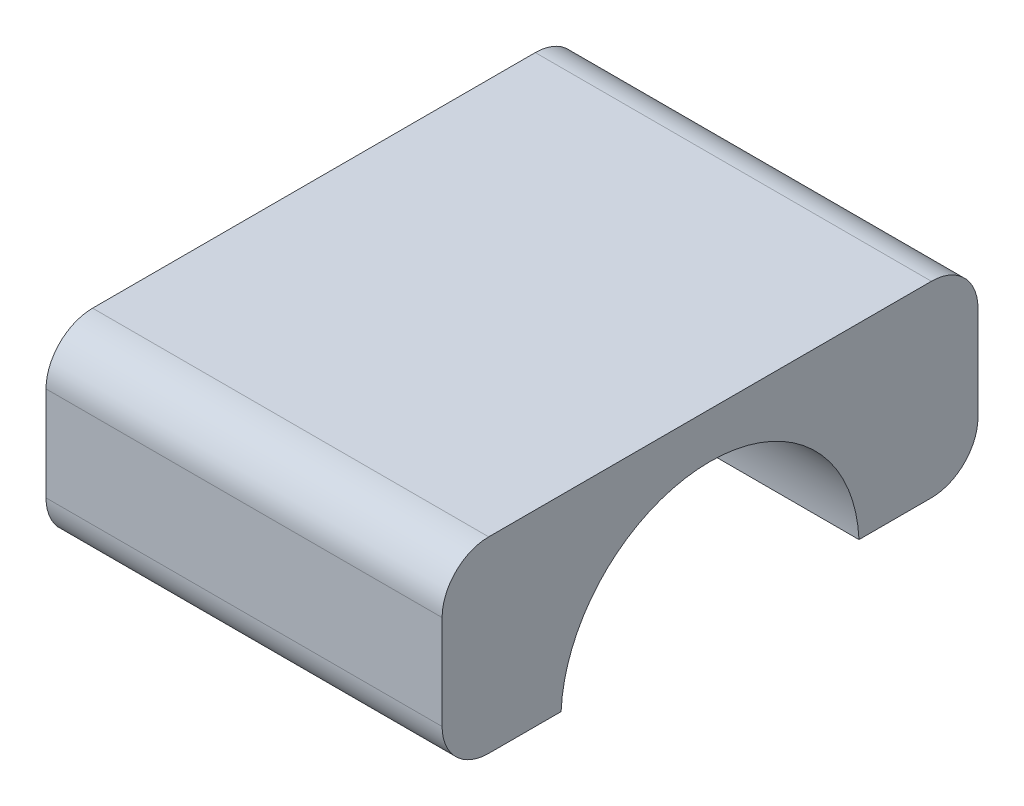
from build123d import *

# Parameters (mm, degrees)
BOSS_EXTRUDE1_DEPTH     = 17
CUT_EXTRUDE1_DEPTH      = 34.119329703
CUT_EXTRUDE1_DEPTH_BACK = 34.119329703
SKETCH2_R               = 12.8
SKETCH3_R               = 2
CUT_EXTRUDE2_DEPTH      = 7.5


with BuildPart() as part:
    # Sketch1 → Boss-Extrude1 (new, symmetric)
    with BuildSketch(Plane(origin=(0, 0, 0), x_dir=(0, 0, -1), z_dir=(1, 0, 0))):
        with BuildLine():
            Line((-19, 0.6), (19, 0.6))
            ThreePointArc((19, 0.6), (21.828427125, 1.771572875), (23, 4.6))
            Line((23, 4.6), (23, 12.7))
            ThreePointArc((23, 12.7), (21.828427125, 15.528427125), (19, 16.7))
            Line((19, 16.7), (-19, 16.7))
            ThreePointArc((-19, 16.7), (-21.828427125, 15.528427125), (-23, 12.7))
            Line((-23, 12.7), (-23, 4.6))
            ThreePointArc((-23, 4.6), (-21.828427125, 1.771572875), (-19, 0.6))
        make_face()
    extrude(amount=BOSS_EXTRUDE1_DEPTH, both=True)

    # Sketch2 → Cut-Extrude1 (cut, two sides: drawn at the far end of the back side and taken through both)
    with BuildSketch(Plane(origin=(0, 0, 0), x_dir=(0, 0, -1), z_dir=(1, 0, 0)).offset(-CUT_EXTRUDE1_DEPTH_BACK)):
        Circle(SKETCH2_R)
    extrude(amount=CUT_EXTRUDE1_DEPTH + CUT_EXTRUDE1_DEPTH_BACK, mode=Mode.SUBTRACT)

    # Sketch3 → Cut-Extrude2 (cut)
    with BuildSketch(Plane(origin=(0, 0.6, 0), x_dir=(1, 0, 0), z_dir=(0, 1, 0))):
        with Locations(Location((12, -17.5, 0), (0, 0, 228.590377891))):
            Circle(SKETCH3_R)
        with Locations(Location((12, 17.5, 0), (0, 0, 48.590377891))):
            Circle(SKETCH3_R)
        with Locations(Location((-12, -17.5, 0), (0, 0, 228.590377891))):
            Circle(SKETCH3_R)
        with Locations(Location((-12, 17.5, 0), (0, 0, 48.590377891))):
            Circle(SKETCH3_R)
    extrude(amount=CUT_EXTRUDE2_DEPTH, mode=Mode.SUBTRACT)


solid = part.part
